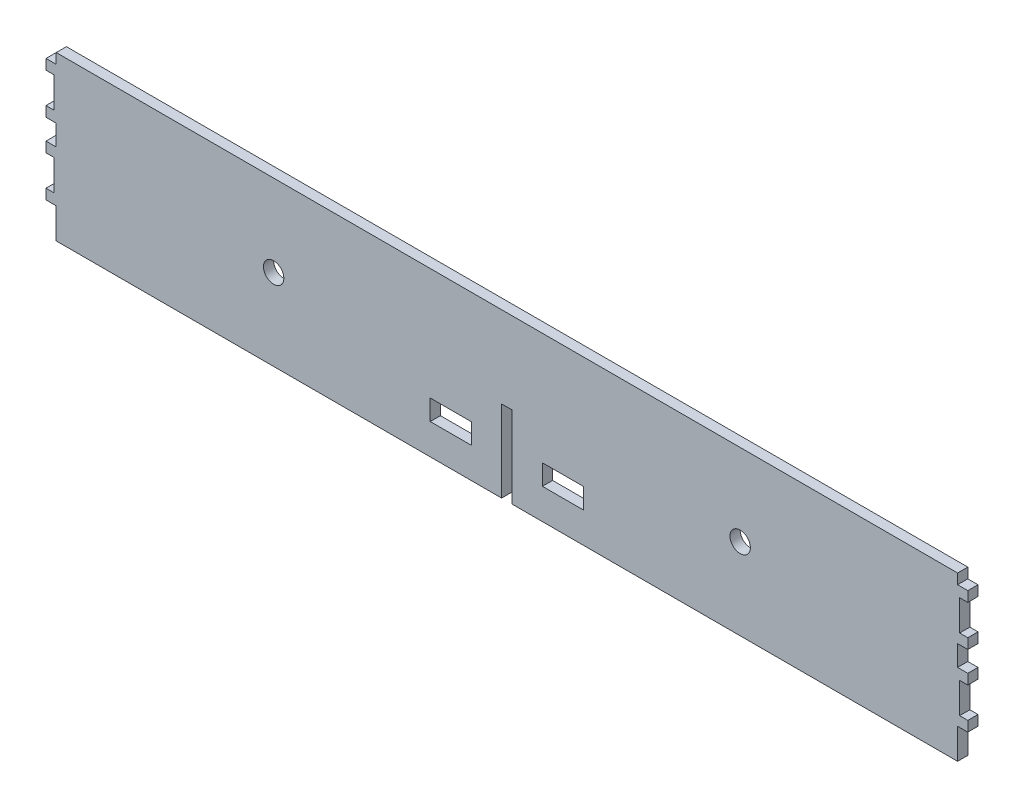
from build123d import *

# Parameters (mm, degrees)
SKETCH1_W           = 442
SKETCH1_H           = 80
BOSS_EXTRUDE1_DEPTH = 2.5
SKETCH7_W           = 5
SKETCH7_H           = 25
BOSS_EXTRUDE2_DEPTH = 5
SKETCH8_W           = 5
SKETCH8_H           = 15
CUT_EXTRUDE6_DEPTH  = 4
SKETCH4_W           = 5.2
SKETCH4_H           = 40
CUT_EXTRUDE7_DEPTH  = 10
SKETCH10_W          = 20.2
SKETCH10_H          = 10
CUT_EXTRUDE8_DEPTH  = 300
SKETCH11_R          = 5
CUT_EXTRUDE9_DEPTH  = 10


with BuildPart() as part:
    # Sketch1 → Boss-Extrude1 (new, symmetric)
    with BuildSketch(Plane.XY):
        with Locations((0, 40)):
            Rectangle(SKETCH1_W, SKETCH1_H)
    extrude(amount=BOSS_EXTRUDE1_DEPTH, both=True)

    # Sketch7 → Boss-Extrude2 (add)
    with BuildSketch(Plane(origin=(221, 0, 0), x_dir=(0, 0, -1), z_dir=(1, 0, 0))):
        with Locations((0, 62.5)):
            Rectangle(SKETCH7_W, SKETCH7_H)
        with Locations((0, 27.4)):
            Rectangle(SKETCH7_W, SKETCH7_H)
    boss_extrude2 = extrude(amount=BOSS_EXTRUDE2_DEPTH)

    # Sketch8 → Cut-Extrude6 (cut)
    with BuildSketch(Plane(origin=(226, 0, 0), x_dir=(0, 0, -1), z_dir=(1, 0, 0))):
        with Locations((0, 62.5)):
            Rectangle(SKETCH8_W, SKETCH8_H)
        with Locations((0, 27.4)):
            Rectangle(SKETCH8_W, SKETCH8_H)
    cut_extrude6 = extrude(amount=-CUT_EXTRUDE6_DEPTH, mode=Mode.SUBTRACT)

    # Mirror8: Boss-Extrude2, Cut-Extrude6 across plane
    add(boss_extrude2.mirror(Plane(origin=(0, 0, 0), x_dir=(0, 0, 1), z_dir=(1, 0, 0))))
    add(cut_extrude6.mirror(Plane(origin=(0, 0, 0), x_dir=(0, 0, 1), z_dir=(1, 0, 0))), mode=Mode.SUBTRACT)

    # Sketch4 → Cut-Extrude7 (cut)
    with BuildSketch(Plane.XY.offset(2.5)):
        with Locations((0, 20)):
            Rectangle(SKETCH4_W, SKETCH4_H)
    extrude(amount=-CUT_EXTRUDE7_DEPTH, mode=Mode.SUBTRACT)

    # Sketch10 → Cut-Extrude8 (cut)
    with BuildSketch(Plane(origin=(0, -565.456150304, -2.5), x_dir=(-1, 0, 0), z_dir=(0, 0, -1))):
        with Locations((27.5, 585.456150304)):
            Rectangle(SKETCH10_W, SKETCH10_H)
    cut_extrude8 = extrude(amount=-CUT_EXTRUDE8_DEPTH, mode=Mode.SUBTRACT)

    # Mirror9: Cut-Extrude8 across plane
    add(cut_extrude8.mirror(Plane(origin=(0, 0, 0), x_dir=(0, 0, 1), z_dir=(1, 0, 0))), mode=Mode.SUBTRACT)

    # Sketch11 → Cut-Extrude9 (cut)
    with BuildSketch(Plane(origin=(0, 0, -2.5), x_dir=(-1, 0, 0), z_dir=(0, 0, -1))):
        with Locations((-114.385224348, 39.9)):
            Circle(SKETCH11_R)
        with Locations(Location((114.385224348, 39.9, 0), (0, 0, 180))):
            Circle(SKETCH11_R)
    extrude(amount=-CUT_EXTRUDE9_DEPTH, mode=Mode.SUBTRACT)


solid = part.part
